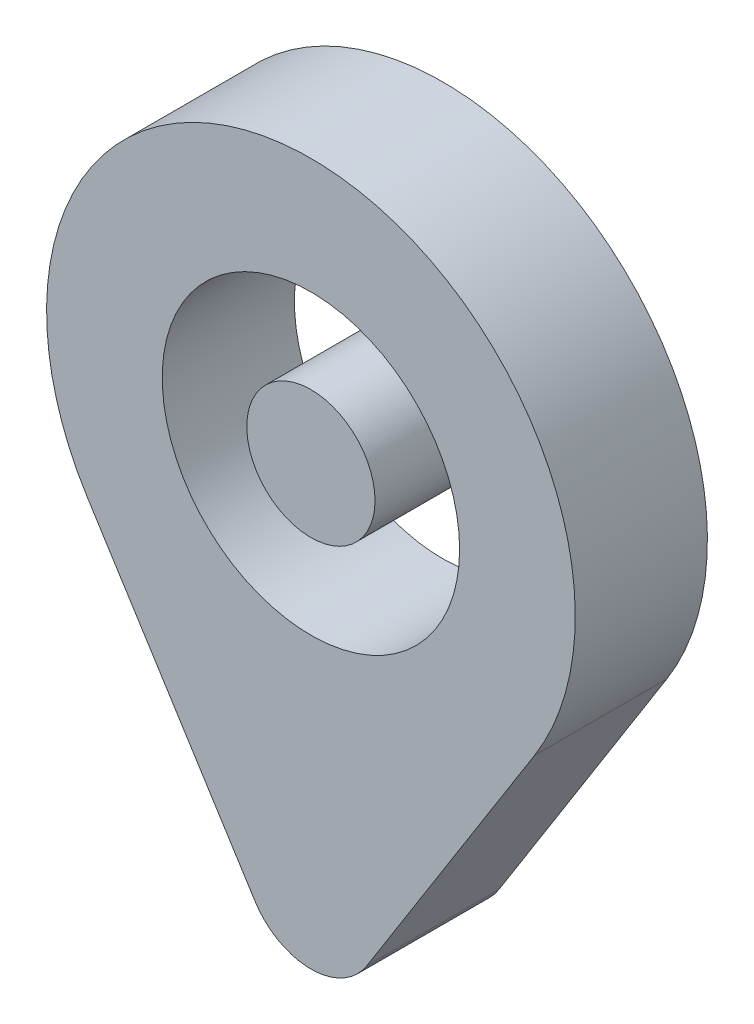
from build123d import *

# Parameters (mm, degrees)
EXTRUDE_1_DEPTH        = 2
EXTRUDE_1_DEPTH_BACK   = 2
SKETCH_2_R             = 4.5
EXTRUDE_1_2_DEPTH      = 2
EXTRUDE_1_2_DEPTH_BACK = 2
SKETCH_2_R_2           = 1.940299118


with BuildPart() as part:
    # 草圖2 → 填料-伸長1 (new, two sides: drawn at the far end of the back side and taken through both)
    with BuildSketch(Plane.XY.offset(-EXTRUDE_1_DEPTH_BACK)):
        with BuildLine():
            ThreePointArc((6.767241355, 10.733333333), (0, 23), (-6.767241355, 10.733333333))
            Line((-6.767241355, 10.733333333), (-1.691810339, 2.683333333))
            ThreePointArc((-1.691810339, 2.683333333), (0, 1.75), (1.691810339, 2.683333333))
            Line((1.691810339, 2.683333333), (6.767241355, 10.733333333))
        make_face()
        with Locations((0, 15)):
            Circle(SKETCH_2_R, mode=Mode.SUBTRACT)
    extrude(amount=EXTRUDE_1_DEPTH + EXTRUDE_1_DEPTH_BACK)


with BuildPart() as body_2:
    # 草圖2 → Extrude 1 2 (new, two sides: drawn at the far end of the back side and taken through both)
    with BuildSketch(Plane.XY.offset(-EXTRUDE_1_2_DEPTH_BACK)):
        with Locations((0, 15)):
            Circle(SKETCH_2_R_2)
    extrude(amount=EXTRUDE_1_2_DEPTH + EXTRUDE_1_2_DEPTH_BACK)


solid = Compound([part.part, body_2.part])
